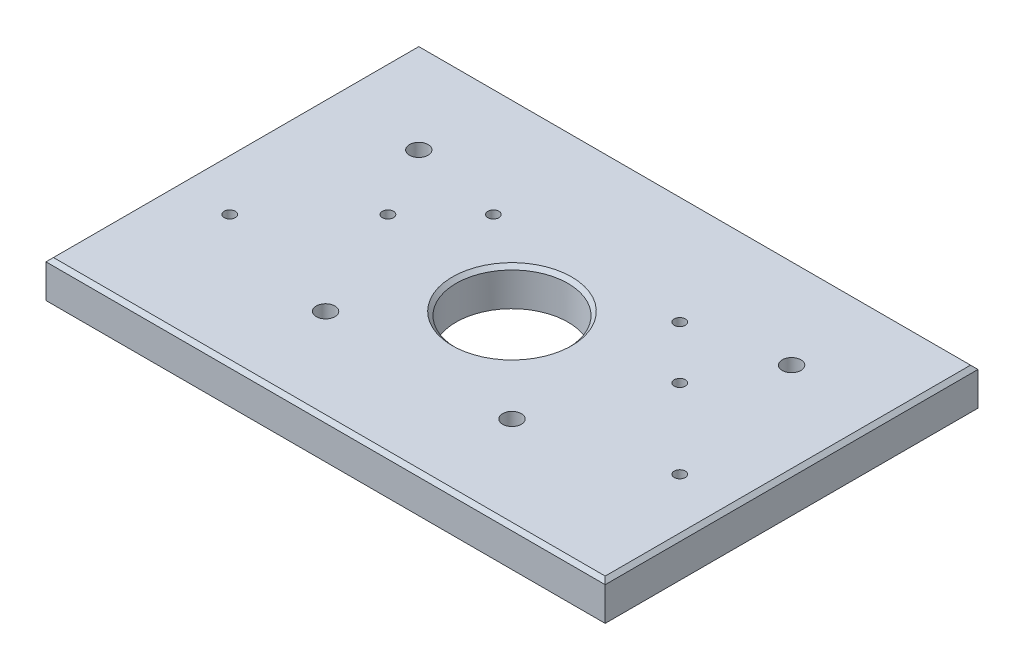
from build123d import *

# Parameters (mm, degrees)
SKETCH1_W           = 150
SKETCH1_H           = 100
BOSS_EXTRUDE1_DEPTH = 10
SKETCH2_R           = 15
SKETCH2_R_2         = 1.5
SKETCH2_R_3         = 2.5
CUT_EXTRUDE1_DEPTH  = 181.554700853
CHAMFER1_SIZE       = 1


with BuildPart() as part:
    # Sketch1 → Boss-Extrude1 (new body)
    with BuildSketch(Plane(origin=(0, 0, 0), x_dir=(1, 0, 0), z_dir=(0, 1, 0))):
        with Locations((75, 50)):
            Rectangle(SKETCH1_W, SKETCH1_H)
    extrude(amount=BOSS_EXTRUDE1_DEPTH)

    # Sketch2 → Cut-Extrude1 (cut, through all)
    with BuildSketch(Plane(origin=(0, 10, 0), x_dir=(1, 0, 0), z_dir=(0, 1, 0))):
        with Locations(Location((75, 50, 0), (0, 0, 270))):
            Circle(SKETCH2_R)
        with Locations(Location((100, 70, 0), (0, 0, 90))):
            Circle(SKETCH2_R_2)
        with Locations(Location((125, 75, 0), (0, 0, 90))):
            Circle(SKETCH2_R_3)
        with Locations(Location((114.142135624, 55.857864376, 0), (0, 0, 90))):
            Circle(SKETCH2_R_2)
        with Locations(Location((135.355339059, 34.644660941, 0), (0, 0, 90))):
            Circle(SKETCH2_R_2)
        with Locations(Location((100, 25, 0), (0, 0, 90))):
            Circle(SKETCH2_R_3)
        with Locations(Location((50, 25, 0), (0, 0, 270))):
            Circle(SKETCH2_R_3)
        with Locations(Location((14.644660941, 34.644660941, 0), (0, 0, 270))):
            Circle(SKETCH2_R_2)
        with Locations(Location((35.857864376, 55.857864376, 0), (0, 0, 270))):
            Circle(SKETCH2_R_2)
        with Locations(Location((50, 70, 0), (0, 0, 270))):
            Circle(SKETCH2_R_2)
        with Locations(Location((25, 75, 0), (0, 0, 270))):
            Circle(SKETCH2_R_3)
    extrude(amount=-CUT_EXTRUDE1_DEPTH, mode=Mode.SUBTRACT)

    # Chamfer1
    chamfer1_edges = [part.edges().sort_by_distance(p)[0] for p in [
        (150, 10, -50),
        (75, 10, -100),
        (75, 10, -65),
        (0, 10, -50),
        (75, 10, 0),
    ]]
    chamfer(chamfer1_edges, length=CHAMFER1_SIZE)


solid = part.part
